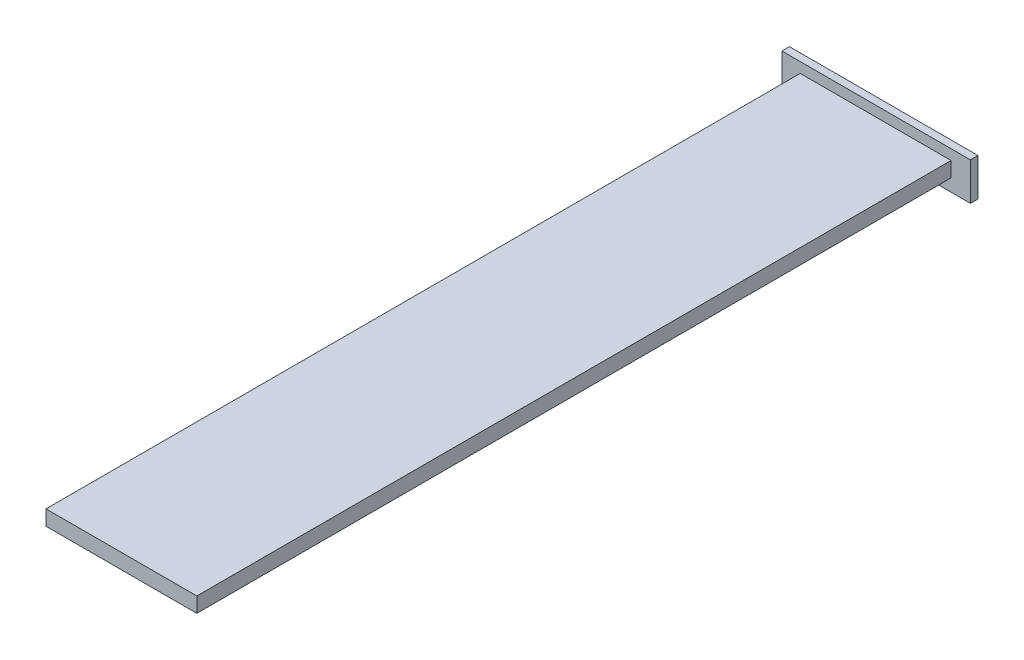
from build123d import *

# Parameters (mm, degrees)
ESBO_O2_W                = 250
ESBO_O2_H                = 50
RESSALTO_EXTRUS_O1_DEPTH = 10
ESBO_O4_W                = 200
ESBO_O4_H                = 20
RESSALTO_EXTRUS_O2_DEPTH = 1000


with BuildPart() as part:
    # Esboço2 → Ressalto-extrusão1 (new body)
    with BuildSketch(Plane.XY):
        with Locations((125, 25)):
            Rectangle(ESBO_O2_W, ESBO_O2_H)
    extrude(amount=RESSALTO_EXTRUS_O1_DEPTH)

    # Esboço4 → Ressalto-extrusão2 (add)
    with BuildSketch(Plane.XY.offset(10)):
        with Locations((124.287859988, 26.407647707)):
            Rectangle(ESBO_O4_W, ESBO_O4_H)
    extrude(amount=RESSALTO_EXTRUS_O2_DEPTH)


solid = part.part
